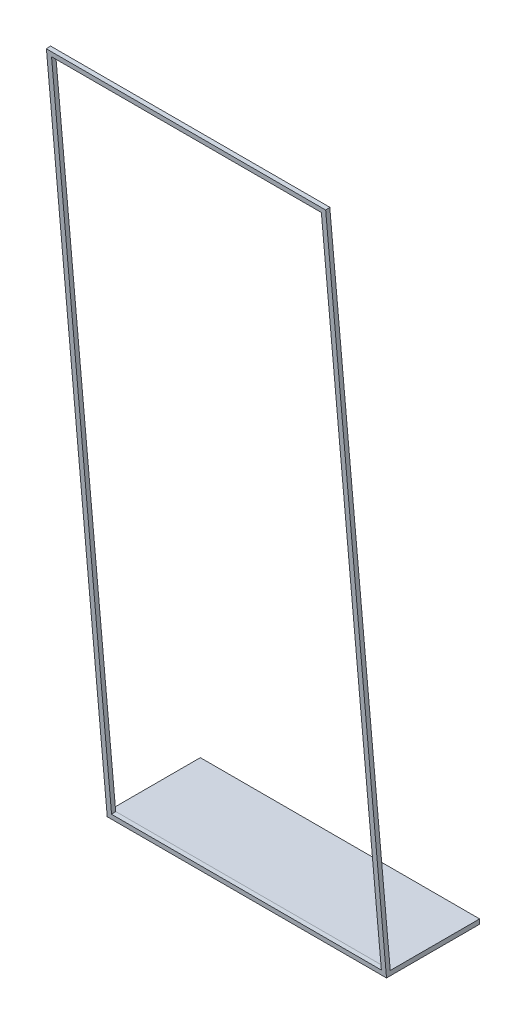
from build123d import *

# Parameters (mm, degrees)
SKETCH2_W                = 6000
SKETCH2_H                = 2000
BOSS_EXTRUDE1_DEPTH      = 100
BOSS_EXTRUDE2_DEPTH      = 3000
BOSS_EXTRUDE2_DEPTH_BACK = 3000
SKETCH4_W                = 5796.8
SKETCH4_H                = 14796.8
CUT_EXTRUDE1_DEPTH       = 15380.28776285


with BuildPart() as part:
    # Sketch2 → Boss-Extrude1 (new body)
    with BuildSketch(Plane(origin=(0, 0, 0), x_dir=(1, 0, 0), z_dir=(0, 1, 0))):
        with Locations((0, 1000)):
            Rectangle(SKETCH2_W, SKETCH2_H)
    extrude(amount=BOSS_EXTRUDE1_DEPTH)

    # Sketch3 → Boss-Extrude2 (add, two sides: drawn at the far end of the back side and taken through both)
    with BuildSketch(Plane(origin=(0, 0, 0), x_dir=(0, 0, -1), z_dir=(1, 0, 0)).offset(-BOSS_EXTRUDE2_DEPTH_BACK)):
        Polygon((0, 0), (-1307.336141215, 14942.920471376), (-1218.774432554, 14950.668616906), (89.239583558, 0), align=None)
    extrude(amount=BOSS_EXTRUDE2_DEPTH + BOSS_EXTRUDE2_DEPTH_BACK)

    # Sketch4 → Cut-Extrude1 (cut, through all)
    with BuildSketch(Plane(origin=(0, 0, 0), x_dir=(1, 0, 0), z_dir=(0, -0.08715574274765157, 0.9961946980917462))):
        with Locations((0, 7500)):
            Rectangle(SKETCH4_W, SKETCH4_H)
    extrude(amount=-CUT_EXTRUDE1_DEPTH, mode=Mode.SUBTRACT)


solid = part.part
